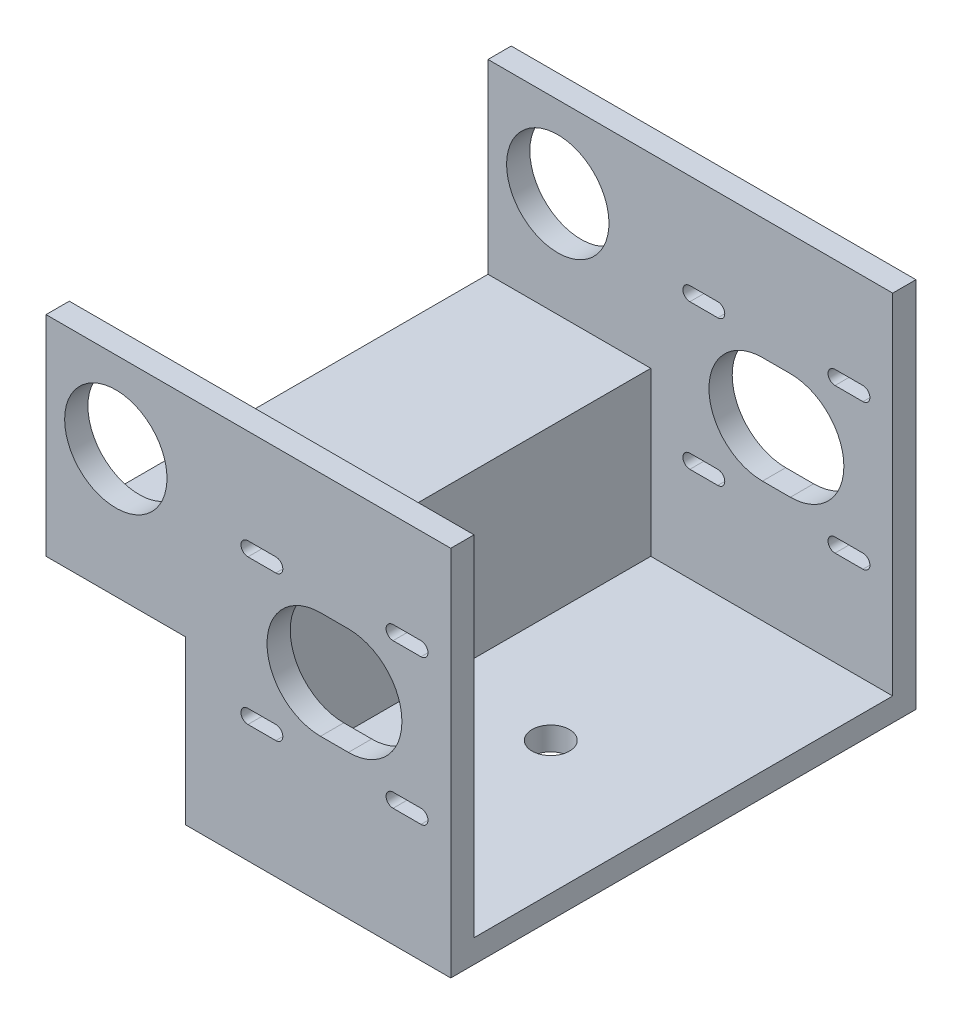
from build123d import *

# Parameters (mm, degrees)
SKETCH1_W           = 57
SKETCH1_H           = 100
BOSS_EXTRUDE1_DEPTH = 80
SKETCH3_W           = 75
SKETCH3_H           = 90
CUT_EXTRUDE1_DEPTH  = 52
SKETCH4_R           = 4.025
CUT_EXTRUDE2_DEPTH  = 114.213294272
BOSS_EXTRUDE2_DEPTH = 30
CUT_EXTRUDE5_REACH  = 112.223
SKETCH8_W           = 90
SKETCH8_H           = 40
SKETCH5_R           = 11
CUT_EXTRUDE3_DEPTH  = 141.791512528


with BuildPart() as part:
    # Sketch1 → Boss-Extrude1 (new body)
    with BuildSketch(Plane(origin=(0, 0, 0), x_dir=(1, 0, 0), z_dir=(0, 1, 0))):
        Rectangle(SKETCH1_W, SKETCH1_H)
    extrude(amount=BOSS_EXTRUDE1_DEPTH)

    # Sketch3 → Cut-Extrude1 (cut)
    with BuildSketch(Plane(origin=(28.5, 40, 0), x_dir=(0, 1, 0), z_dir=(-1, 0, 0))):
        with Locations((2.5, 0)):
            Rectangle(SKETCH3_W, SKETCH3_H)
    extrude(amount=CUT_EXTRUDE1_DEPTH, mode=Mode.SUBTRACT)

    # Sketch4 → Cut-Extrude2 (cut, through all)
    with BuildSketch(Plane(origin=(-40, 5, 0), x_dir=(-1, 0, 0), z_dir=(0, -1, 0))):
        with Locations(Location((-40, 0, 0), (0, 0, 90))):
            Circle(SKETCH4_R)
    extrude(amount=CUT_EXTRUDE2_DEPTH, mode=Mode.SUBTRACT)

    # Sketch7 → Boss-Extrude2 (add)
    with BuildSketch(Plane.ZY.offset(28.5)):
        Polygon((-50, 80), (-45, 80), (-45, 40), (45, 40), (45, 80), (50, 80), (50, 35), (-50, 35), align=None)
    extrude(amount=BOSS_EXTRUDE2_DEPTH)

    # Sketch8 → Cut-Extrude5 (cut, up to next)
    with BuildSketch(Plane.ZY.offset(28.5), mode=Mode.PRIVATE) as cut_extrude5_sk1:
        with Locations((0, 60)):
            Rectangle(SKETCH8_W, SKETCH8_H)
    cut_extrude5_tool1 = extrude(cut_extrude5_sk1.sketch, amount=-CUT_EXTRUDE5_REACH, mode=Mode.PRIVATE) & part.part
    add(cut_extrude5_tool1.solids().sort_by_distance((-28.5, 60, 0))[0], mode=Mode.SUBTRACT)

    # Sketch5 → Cut-Extrude3 (cut, through all)
    with BuildSketch(Plane(origin=(0, 0, -50), x_dir=(-1, 0, 0), z_dir=(0, 0, -1))):
        with Locations((43.5, 62.5)):
            Circle(SKETCH5_R)
        with BuildLine():
            Line((-22.1, 59.6), (-16.1, 59.6))
            ThreePointArc((-16.1, 59.6), (-14.6, 58.1), (-16.1, 56.6))
            Line((-16.1, 56.6), (-22.1, 56.6))
            ThreePointArc((-22.1, 56.6), (-23.6, 58.1), (-22.1, 59.6))
        make_face()
        with BuildLine():
            Line((-0.5, 31), (-6.5, 31))
            ThreePointArc((-6.5, 31), (-18, 42.5), (-6.5, 54))
            Line((-6.5, 54), (-0.5, 54))
            ThreePointArc((-0.5, 54), (11, 42.5), (-0.5, 31))
        make_face()
        with BuildLine():
            Line((-22.1, 25.4), (-16.1, 25.4))
            ThreePointArc((-16.1, 25.4), (-14.6, 26.9), (-16.1, 28.4))
            Line((-16.1, 28.4), (-22.1, 28.4))
            ThreePointArc((-22.1, 28.4), (-23.6, 26.9), (-22.1, 25.4))
        make_face()
        with BuildLine():
            Line((15.1, 25.4), (9.1, 25.4))
            ThreePointArc((9.1, 25.4), (7.6, 26.9), (9.1, 28.4))
            Line((9.1, 28.4), (15.1, 28.4))
            ThreePointArc((15.1, 28.4), (16.6, 26.9), (15.1, 25.4))
        make_face()
        with BuildLine():
            Line((15.1, 59.6), (9.1, 59.6))
            ThreePointArc((9.1, 59.6), (7.6, 58.1), (9.1, 56.6))
            Line((9.1, 56.6), (15.1, 56.6))
            ThreePointArc((15.1, 56.6), (16.6, 58.1), (15.1, 59.6))
        make_face()
    extrude(amount=-CUT_EXTRUDE3_DEPTH, mode=Mode.SUBTRACT)


solid = part.part
